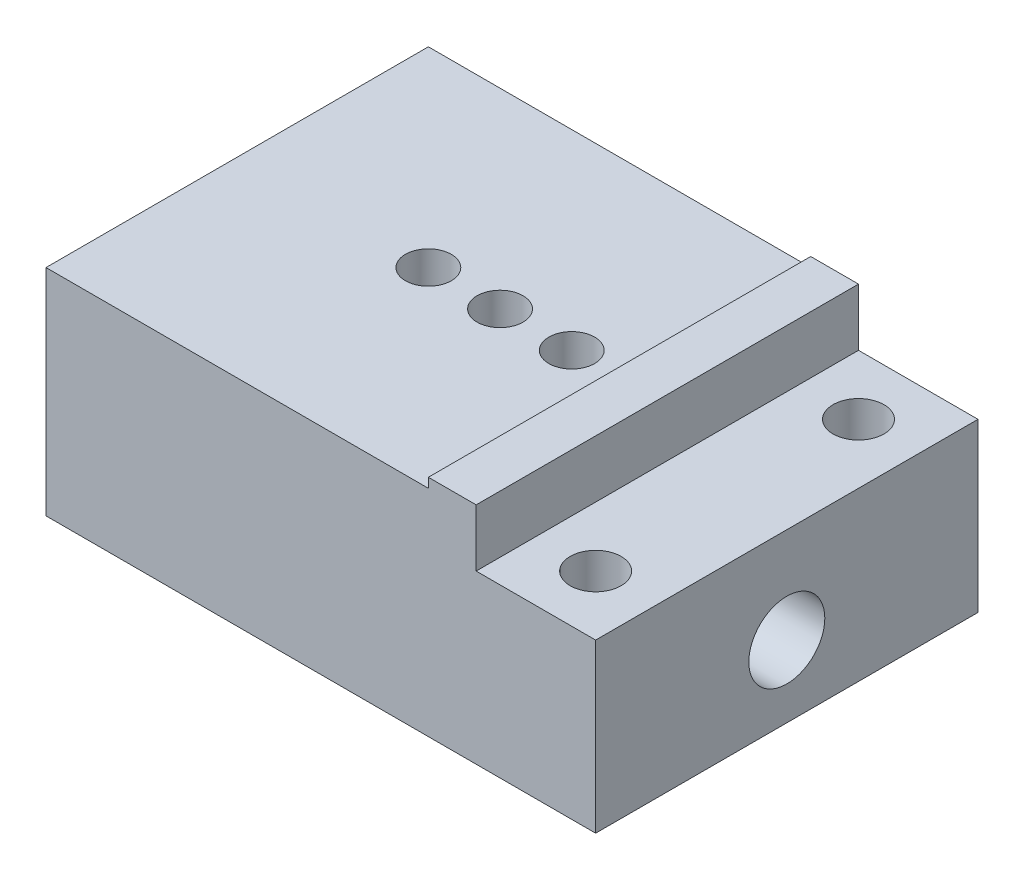
from build123d import *

# Parameters (mm, degrees)
BOSS_EXTRUDE1_DEPTH                 = 20.32
F_2_CLEARANCE_HOLE1_D               = 2.4384
F_2_CLEARANCE_HOLE1_DEPTH           = 7.62
F_2_CLEARANCE_HOLE1_TIP             = 0.732569267
TAP_DRILL_FOR_10_32_TAP1_D          = 4.0386
TAP_DRILL_FOR_10_32_TAP1_DEPTH      = 20.32
TAP_DRILL_FOR_10_32_TAP1_TIP        = 1.213317848
F_5_64_0_07813_DIAMETER_HOLE1_D     = 1.984502
F_5_64_0_07813_DIAMETER_HOLE1_DEPTH = 12.7
F_5_64_0_07813_DIAMETER_HOLE1_TIP   = 0.59620455
TAP_DRILL_FOR_6_32_TAP1_D           = 2.7051


with BuildPart() as part:
    # Sketch1 → Boss-Extrude1 (new body)
    with BuildSketch(Plane.XY):
        Polygon((0, 0), (25.4, 0), (29.21, 0), (29.21, 8.89), (22.86, 8.89), (22.86, 11.938), (20.32, 11.938), (20.32, 11.43), (0, 11.43), align=None)
    extrude(amount=BOSS_EXTRUDE1_DEPTH)

    # #2 Clearance Hole1
    with Locations(Plane(origin=(17.78, 11.43, 10.16), x_dir=(0, 0, 1), z_dir=(0, 1, 0))):
        with Locations((0, 0), (0, -3.81), (0, -7.62)):
            Hole(F_2_CLEARANCE_HOLE1_D / 2, depth=F_2_CLEARANCE_HOLE1_DEPTH)
            with Locations((0, 0, -(F_2_CLEARANCE_HOLE1_DEPTH + F_2_CLEARANCE_HOLE1_TIP / 2))):  # 118° drill point
                Cone(0, F_2_CLEARANCE_HOLE1_D / 2, F_2_CLEARANCE_HOLE1_TIP, mode=Mode.SUBTRACT)

    # Tap Drill for #10-32 Tap1
    with Locations(Plane(origin=(29.21, 3.81, 10.16), x_dir=(0, 1, 0), z_dir=(1, 0, 0))):
        with Locations((0, 0)):
            Hole(TAP_DRILL_FOR_10_32_TAP1_D / 2, depth=TAP_DRILL_FOR_10_32_TAP1_DEPTH)
            with Locations((0, 0, -(TAP_DRILL_FOR_10_32_TAP1_DEPTH + TAP_DRILL_FOR_10_32_TAP1_TIP / 2))):  # 118° drill point
                Cone(0, TAP_DRILL_FOR_10_32_TAP1_D / 2, TAP_DRILL_FOR_10_32_TAP1_TIP, mode=Mode.SUBTRACT)

    # 5/64 (0.07813) Diameter Hole1
    with Locations(Plane(origin=(0, 9.652, 6.35), x_dir=(0, 0, -1), z_dir=(-1, 0, 0))):
        with Locations((0, 0)):
            Hole(F_5_64_0_07813_DIAMETER_HOLE1_D / 2, depth=F_5_64_0_07813_DIAMETER_HOLE1_DEPTH)
            with Locations((0, 0, -(F_5_64_0_07813_DIAMETER_HOLE1_DEPTH + F_5_64_0_07813_DIAMETER_HOLE1_TIP / 2))):  # 118° drill point
                Cone(0, F_5_64_0_07813_DIAMETER_HOLE1_D / 2, F_5_64_0_07813_DIAMETER_HOLE1_TIP, mode=Mode.SUBTRACT)

    # Tap Drill for #6-32 Tap1 (through all)
    with Locations(Plane(origin=(26.035, 8.89, 17.145), x_dir=(0, 0, 1), z_dir=(0, 1, 0))):
        with Locations((0, 0), (-13.97, 0)):
            Hole(TAP_DRILL_FOR_6_32_TAP1_D / 2)


solid = part.part
